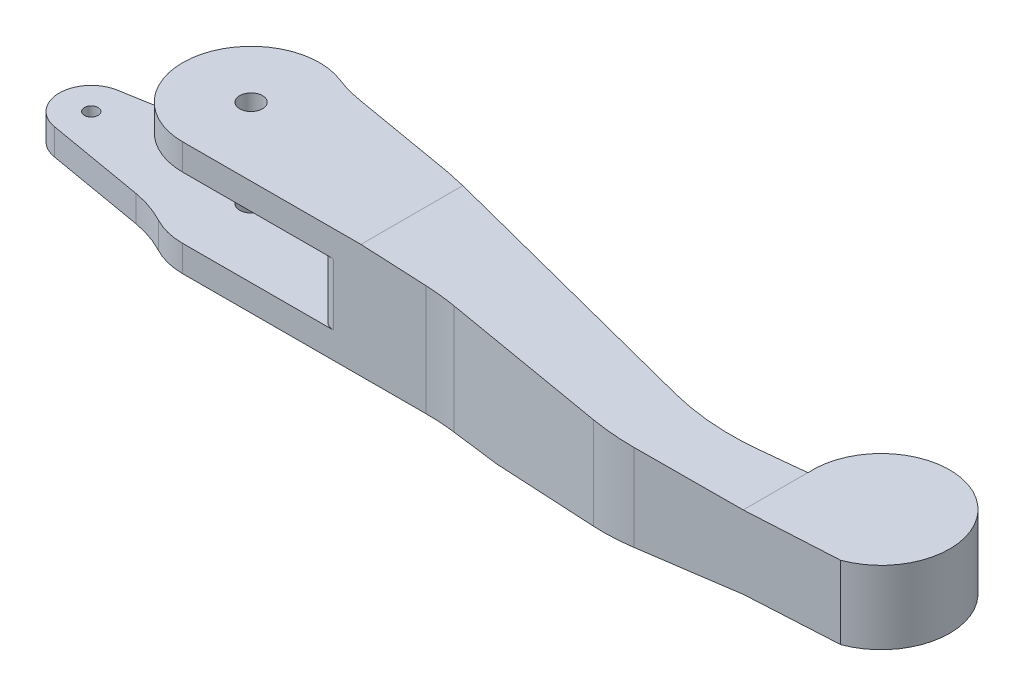
from build123d import *

# Parameters (mm, degrees)
SKETCH1_R                      = 2.5
BOSS_EXTRUDE1_DEPTH            = 12.5
CUT_EXTRUDE1_START             = -11.265362
CUT_EXTRUDE1_DEPTH             = 31.539115
FILLET1_R                      = 30
CUT_EXTRUDE2_REACH             = 160.449
SKETCH3_W                      = 45
SKETCH3_H                      = 13.5
CUT_EXTRUDE2_DIRECTION_2_REACH = 160.449
FILLET2_R                      = 3
BOSS_EXTRUDE2_START            = -19.25
SKETCH4_R                      = 1.5
BOSS_EXTRUDE2_DEPTH            = 5.75
FILLET3_R                      = 25


with BuildPart() as part:
    # Sketch1 → Boss-Extrude1 (new, symmetric)
    with BuildSketch(Plane(origin=(0, 0, 0), x_dir=(1, 0, 0), z_dir=(0, 1, 0))):
        with BuildLine():
            Line((0.025763833, -14.999977874), (53.199697381, -14.908646781))
            ThreePointArc((53.199697381, -14.908646781), (56.45455329, -15.0090982), (59.695967444, -15.321206773))
            Line((59.695967444, -15.321206773), (94.814307977, -19.861118805))
            ThreePointArc((94.814307977, -19.861118805), (99.407289265, -20.240711866), (104.015710949, -20.195794275))
            Line((104.015710949, -20.195794275), (146.859436035, -17.800512314))
            ThreePointArc((146.859436035, -17.800512314), (149.78171872, 8.869128334), (126.685409546, -4.782610416))
            Line((126.685409546, -4.782610416), (117.214630993, -6.293002063))
            ThreePointArc((117.214630993, -6.293002063), (107.884245813, -6.895762667), (98.604771495, -5.750876498))
            Line((98.604771495, -5.750876498), (35.849829613, 8.04486691))
            ThreePointArc((35.849829613, 8.04486691), (34.736624271, 8.276351777), (33.61844305, 8.482463724))
            Line((33.61844305, 8.482463724), (7.5, 12.990381057))
            ThreePointArc((7.5, 12.990381057), (-14.492216138, 3.869841264), (0.025763833, -14.999977874))
        make_face()
        with Locations(Location((0, 0, 0), (0, 0, 270))):
            Circle(SKETCH1_R, mode=Mode.SUBTRACT)
    extrude(amount=BOSS_EXTRUDE1_DEPTH, both=True)

    # Sketch2 → Cut-Extrude1 (cut)
    with BuildSketch(Plane.XY.offset(CUT_EXTRUDE1_START)):
        Polygon((38.980933682, -15), (126.64875656, -8), (156.64875656, -8), (156.64875656, -15), align=None)
        Polygon((156.64875656, 8), (156.64875656, 12.5), (38.980933682, 12.5), (126.64875656, 8), align=None)
    extrude(amount=CUT_EXTRUDE1_DEPTH, mode=Mode.SUBTRACT)

    # Fillet1
    fillet1_edges = [part.edges().sort_by_distance(p)[0] for p in [
        (7.5, 0, -12.990381057),
    ]]
    fillet(fillet1_edges, radius=FILLET1_R)

    # Sketch3 → Cut-Extrude2 (cut, up to next)
    with BuildSketch(Plane.XY, mode=Mode.PRIVATE) as cut_extrude2_sk1:
        with Locations((7.5, 0)):
            Rectangle(SKETCH3_W, SKETCH3_H)
    cut_extrude2_tool1 = extrude(cut_extrude2_sk1.sketch, amount=-CUT_EXTRUDE2_REACH, mode=Mode.PRIVATE) & part.part
    add(cut_extrude2_tool1.solids().sort_by_distance((7.5, 0, 0))[0], mode=Mode.SUBTRACT)

    # Sketch3 → Cut-Extrude2 direction 2 (cut, up to next)
    with BuildSketch(Plane.XY, mode=Mode.PRIVATE) as cut_extrude2_direction_2_sk1:
        with Locations((7.5, 0)):
            Rectangle(SKETCH3_W, SKETCH3_H)
    cut_extrude2_direction_2_tool1 = extrude(cut_extrude2_direction_2_sk1.sketch, amount=CUT_EXTRUDE2_DIRECTION_2_REACH, mode=Mode.PRIVATE) & part.part
    add(cut_extrude2_direction_2_tool1.solids().sort_by_distance((7.5, 0, 0))[0], mode=Mode.SUBTRACT)

    # Fillet2
    fillet2_edges = [part.edges().sort_by_distance(p)[0] for p in [
        (30, 0, 14.948494383),
        (30, 0, -9.106989547),
    ]]
    fillet(fillet2_edges, radius=FILLET2_R)

    # Sketch4 → Boss-Extrude2 (add)
    with BuildSketch(Plane(origin=(0, 12.5, 0), x_dir=(1, 0, 0), z_dir=(0, 1, 0)).offset(BOSS_EXTRUDE2_START)):
        with BuildLine():
            Line((-9.630680142, 11.5), (-36.195071959, 6.897231547))
            ThreePointArc((-36.195071959, 6.897231547), (-42, 0), (-36.195071959, -6.897231547))
            Line((-36.195071959, -6.897231547), (-9.630680142, -11.5))
            ThreePointArc((-9.630680142, -11.5), (-15, 0), (-9.630680142, 11.5))
        make_face()
        with Locations(Location((-35, 0, 0), (0, 0, 270))):
            Circle(SKETCH4_R, mode=Mode.SUBTRACT)
    extrude(amount=-BOSS_EXTRUDE2_DEPTH)

    # Fillet3
    fillet3_edges = [part.edges().sort_by_distance(p)[0] for p in [
        (-9.630680142, -9.625, -11.5),
        (-9.630680142, -9.625, 11.5),
    ]]
    fillet(fillet3_edges, radius=FILLET3_R)


solid = part.part
